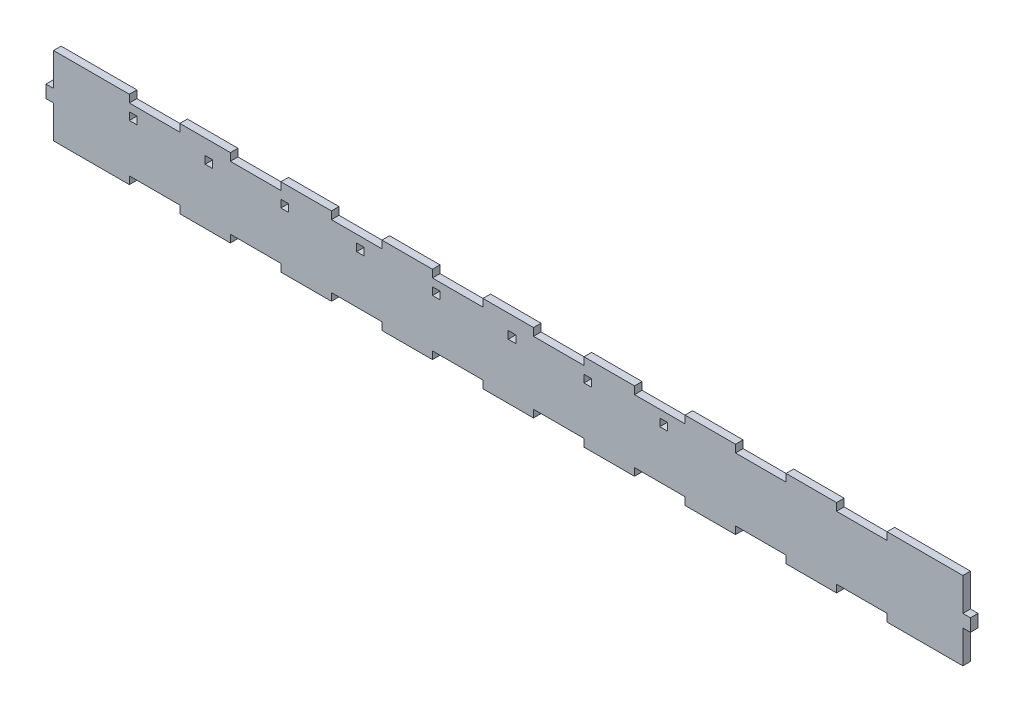
from build123d import *

# Parameters (mm, degrees)
SKETCH1_W           = 3
SKETCH1_H           = 3
BOSS_EXTRUDE2_DEPTH = 3


with BuildPart() as part:
    # Sketch1 → Boss-Extrude2 (new body)
    with BuildSketch(Plane.XY):
        Polygon((28.442880719, -76.852652167), (28.442880719, -79.852652167), (8.442880719, -79.852652167), (8.442880719, -76.852652167), (-11.557119281, -76.852652167), (-11.557119281, -79.852652167), (-31.557119281, -79.852652167), (-31.557119281, -76.852652167), (-61.557119281, -76.852652167), (-61.557119281, -79.852652167), (-61.557119281, -89.852652167), (-64.557119281, -89.852652167), (-64.557119281, -94.852652167), (-61.557119281, -94.852652167), (-61.557119281, -104.852652167), (-61.557119281, -107.852652167), (-31.557119281, -107.852652167), (-31.557119281, -104.852652167), (-11.557119281, -104.852652167), (-11.557119281, -107.852652167), (8.442880719, -107.852652167), (8.442880719, -104.852652167), (28.442880719, -104.852652167), (28.442880719, -107.852652167), (48.442880719, -107.852652167), (48.442880719, -104.852652167), (68.442880719, -104.852652167), (68.442880719, -107.852652167), (88.442880719, -107.852652167), (88.442880719, -104.852652167), (108.442880719, -104.852652167), (108.442880719, -107.852652167), (128.442880719, -107.852652167), (128.442880719, -104.852652167), (148.442880719, -104.852652167), (148.442880719, -107.852652167), (168.442880719, -107.852652167), (168.442880719, -104.852652167), (188.442880719, -104.852652167), (188.442880719, -107.852652167), (208.442880719, -107.852652167), (208.442880719, -104.852652167), (228.442880719, -104.852652167), (228.442880719, -107.852652167), (248.442880719, -107.852652167), (248.442880719, -104.852652167), (268.442880719, -104.852652167), (268.442880719, -107.852652167), (298.442880719, -107.852652167), (298.442880719, -104.852652167), (298.442880719, -94.852652167), (301.442880719, -94.852652167), (301.442880719, -89.852652167), (298.442880719, -89.852652167), (298.442880719, -79.852652167), (298.442880719, -76.852652167), (268.442880719, -76.852652167), (268.442880719, -79.852652167), (248.442880719, -79.852652167), (248.442880719, -76.852652167), (228.442880719, -76.852652167), (228.442880719, -79.852652167), (208.442880719, -79.852652167), (208.442880719, -76.852652167), (188.442880719, -76.852652167), (188.442880719, -79.852652167), (168.442880719, -79.852652167), (168.442880719, -76.852652167), (148.442880719, -76.852652167), (148.442880719, -79.852652167), (128.442880719, -79.852652167), (128.442880719, -76.852652167), (108.442880719, -76.852652167), (108.442880719, -79.852652167), (88.442880719, -79.852652167), (88.442880719, -76.852652167), (68.442880719, -76.852652167), (68.442880719, -79.852652167), (48.442880719, -79.852652167), (48.442880719, -76.852652167), align=None)
        with Locations((-0.057119281, -84.352652167)):
            Rectangle(SKETCH1_W, SKETCH1_H, mode=Mode.SUBTRACT)
        with Locations((-30.057119281, -84.352652167)):
            Rectangle(SKETCH1_W, SKETCH1_H, mode=Mode.SUBTRACT)
        with Locations((29.942880719, -84.352652167)):
            Rectangle(SKETCH1_W, SKETCH1_H, mode=Mode.SUBTRACT)
        with Locations((59.942880719, -84.352652167)):
            Rectangle(SKETCH1_W, SKETCH1_H, mode=Mode.SUBTRACT)
        with Locations((89.942880719, -84.352652167)):
            Rectangle(SKETCH1_W, SKETCH1_H, mode=Mode.SUBTRACT)
        with Locations((119.942880719, -84.352652167)):
            Rectangle(SKETCH1_W, SKETCH1_H, mode=Mode.SUBTRACT)
        with Locations((149.942880719, -84.352652167)):
            Rectangle(SKETCH1_W, SKETCH1_H, mode=Mode.SUBTRACT)
        with Locations((179.942880719, -84.352652167)):
            Rectangle(SKETCH1_W, SKETCH1_H, mode=Mode.SUBTRACT)
    extrude(amount=BOSS_EXTRUDE2_DEPTH)


solid = part.part
